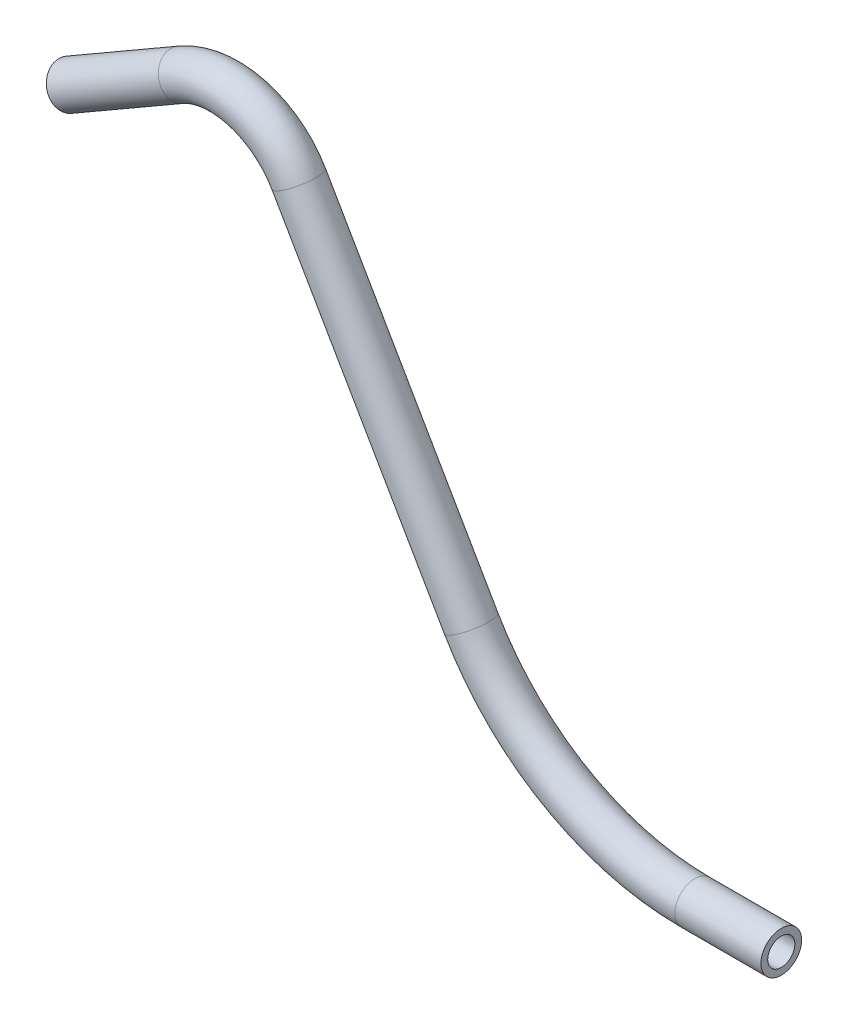
from build123d import *

# Parameters (mm, degrees)
SKETCH1_R   = 3
SKETCH1_R_2 = 2


with BuildPart() as part:
    # Sweep1: sweep along a path in Sketch2
    with BuildLine(Plane.XY) as sweep1_path:
        Line((0, 0), (-12.7, 0))
        ThreePointArc((-12.7, 0), (-31.75, 5.104432116), (-45.695567884, 19.05))
        Line((-45.695567884, 19.05), (-71.095567884, 63.044090512))
        ThreePointArc((-71.095567884, 63.044090512), (-78.807088639, 68.961348506), (-88.444090512, 67.69261314))
        Line((-88.444090512, 67.69261314), (-104.941874454, 58.16761314))
    # Sketch1 → Sweep1 (sweep)
    with BuildSketch(Plane(origin=(0, 0, 0), x_dir=(0, 0, -1), z_dir=(1, 0, 0))):
        Circle(SKETCH1_R)
        Circle(SKETCH1_R_2, mode=Mode.SUBTRACT)
    sweep(path=sweep1_path.line)


solid = part.part
